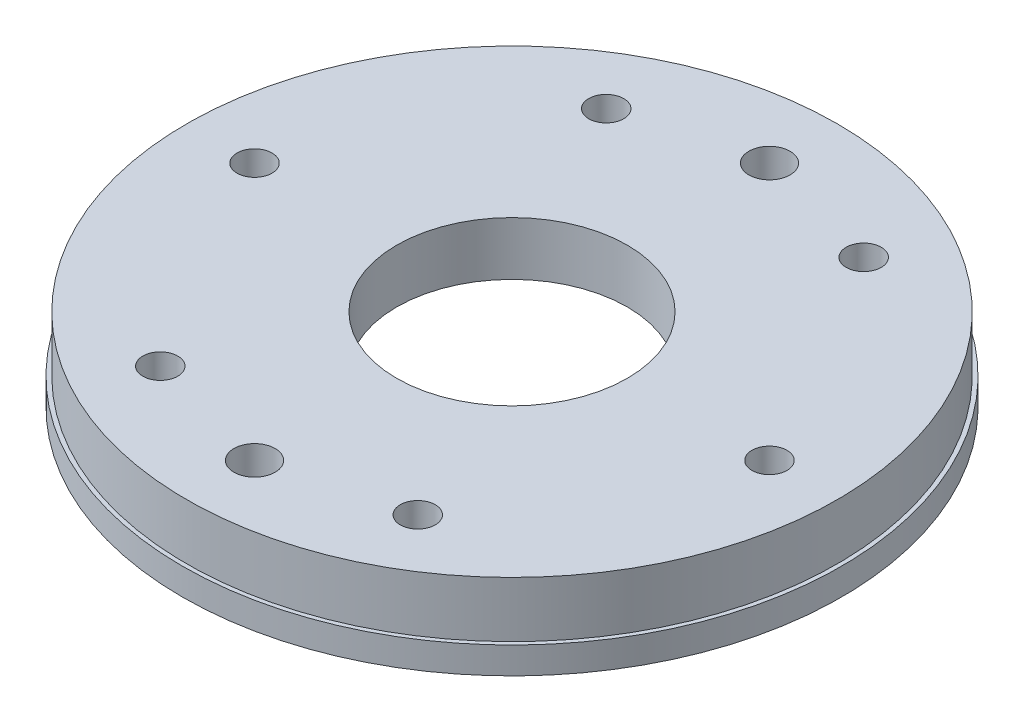
from build123d import *

# Parameters (mm, degrees)
SCHIZZO2_R                  = 28
TAGLIO_ESTRUSIONE1_DEPTH    = 115.891252931
RIPETIZIONECIRCOLARE1_COUNT = 6
SCHIZZO5_R                  = 5
TAGLIO_ESTRUSIONE2_DEPTH    = 115.891252931
SCHIZZO6_R                  = 40
TAGLIO_ESTRUSIONE3_DEPTH    = 7


with BuildPart() as part:
    # Schizzo1 → Rivoluzione1 (revolve)
    with BuildSketch(Plane.XY, mode=Mode.PRIVATE) as rivoluzione1_sk:
        Polygon((0, 0), (80, 0), (80, 6.5), (79, 6.5), (79, 20), (0, 20), align=None)
    revolve(rivoluzione1_sk.sketch.rotate(Axis((0, 0, 0), (0, 1, 0)), 90), axis=Axis((0, 0, 0), (0, 1, 0)))

    # Schizzo2 → Taglio-Estrusione1 (cut, through all)
    with BuildSketch(Plane.XZ):
        with Locations(Location((0, 0, 0), (0, 0, 270))):
            Circle(SCHIZZO2_R)
    extrude(amount=-TAGLIO_ESTRUSIONE1_DEPTH, mode=Mode.SUBTRACT)

    # Schizzo3 → M10 Foro filettato profondo1 (revolve, cut)
    with BuildSketch(Plane(origin=(62.5, 0, 0), x_dir=(0, 0, -1), z_dir=(1, 0, 0))):
        Polygon((0, 0), (0, 27.553657631), (4.25, 25), (4.25, 0), align=None)
    m10_foro_filettato_profondo1 = revolve(axis=Axis((62.5, -6.35, 0), (0, 1, 0)), mode=Mode.SUBTRACT)

    # RipetizioneCircolare1: M10 Foro filettato profondo1 ×6 about axis
    ripetizionecircolare1_axis = Axis((0, 0, 0), (0, 1, 0))
    for i in range(1, RIPETIZIONECIRCOLARE1_COUNT):
        add(m10_foro_filettato_profondo1.rotate(ripetizionecircolare1_axis, i * 360 / RIPETIZIONECIRCOLARE1_COUNT), mode=Mode.SUBTRACT)

    # Schizzo5 → Taglio-Estrusione2 (cut, through all)
    with BuildSketch(Plane.XZ):
        with Locations(Location((0, 62.5, 0), (0, 0, 270))):
            Circle(SCHIZZO5_R)
        with Locations(Location((0, -62.5, 0), (0, 0, 270))):
            Circle(SCHIZZO5_R)
    extrude(amount=-TAGLIO_ESTRUSIONE2_DEPTH, mode=Mode.SUBTRACT)

    # Schizzo6 → Taglio-Estrusione3 (cut)
    with BuildSketch(Plane.XZ):
        with Locations(Location((0, 0, 0), (0, 0, 270))):
            Circle(SCHIZZO6_R)
    extrude(amount=-TAGLIO_ESTRUSIONE3_DEPTH, mode=Mode.SUBTRACT)


solid = part.part
